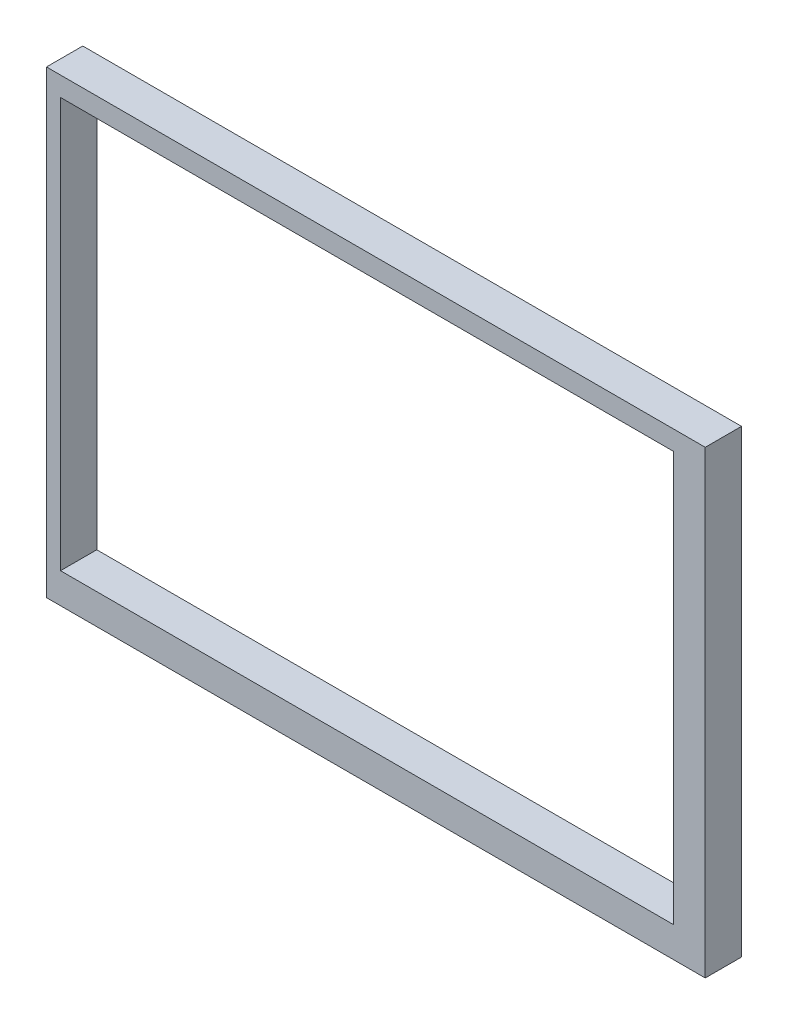
from build123d import *

# Parameters (mm, degrees)
SKETCH2_W           = 90.811996209
SKETCH2_H           = 63.360315375
SKETCH2_W_2         = 84.5
SKETCH2_H_2         = 56.5
BOSS_EXTRUDE1_DEPTH = 5


with BuildPart() as part:
    # Sketch2 → Boss-Extrude1 (new body)
    with BuildSketch(Plane.XY):
        with Locations((-3.290072774, 4.005512575)):
            Rectangle(SKETCH2_W, SKETCH2_H)
        with Locations((-4.513097072, 4.759244992)):
            Rectangle(SKETCH2_W_2, SKETCH2_H_2, mode=Mode.SUBTRACT)
    extrude(amount=BOSS_EXTRUDE1_DEPTH)


solid = part.part
